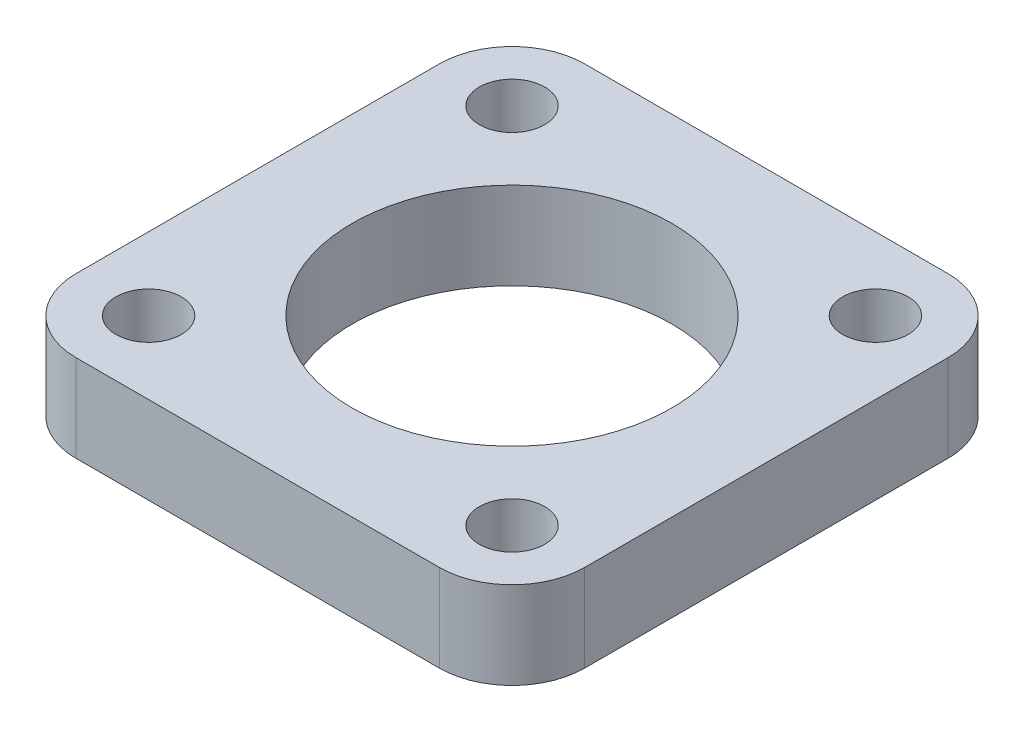
from build123d import *

# Parameters (mm, degrees)
CROQUIS1_W                   = 35
CROQUIS1_H                   = 35
CROQUIS1_R                   = 11
SALIENTE_EXTRUIR1_DEPTH      = 3
TALADRO_DE_MARGEN_PARA_M41_D = 4.5
REDONDEO1_R                  = 5


with BuildPart() as part:
    # Croquis1 → Saliente-Extruir1 (new, symmetric)
    with BuildSketch(Plane(origin=(0, 0, 0), x_dir=(1, 0, 0), z_dir=(0, 1, 0))):
        Rectangle(CROQUIS1_W, CROQUIS1_H)
        with Locations(Location((0, 0, 0), (0, 0, 270))):
            Circle(CROQUIS1_R, mode=Mode.SUBTRACT)
    extrude(amount=SALIENTE_EXTRUIR1_DEPTH, both=True)

    # Taladro de margen para M41 (through all)
    with Locations(Plane(origin=(0, 3, 0), x_dir=(1, 0, 0), z_dir=(0, 1, 0))):
        with Locations((12.5, 12.5), (-12.5, 12.5), (-12.5, -12.5), (12.5, -12.5)):
            Hole(TALADRO_DE_MARGEN_PARA_M41_D / 2)

    # Redondeo1
    redondeo1_edges = [part.edges().sort_by_distance(p)[0] for p in [
        (17.5, 0, 17.5),
        (-17.5, 0, 17.5),
        (-17.5, 0, -17.5),
        (17.5, 0, -17.5),
    ]]
    fillet(redondeo1_edges, radius=REDONDEO1_R)


solid = part.part
